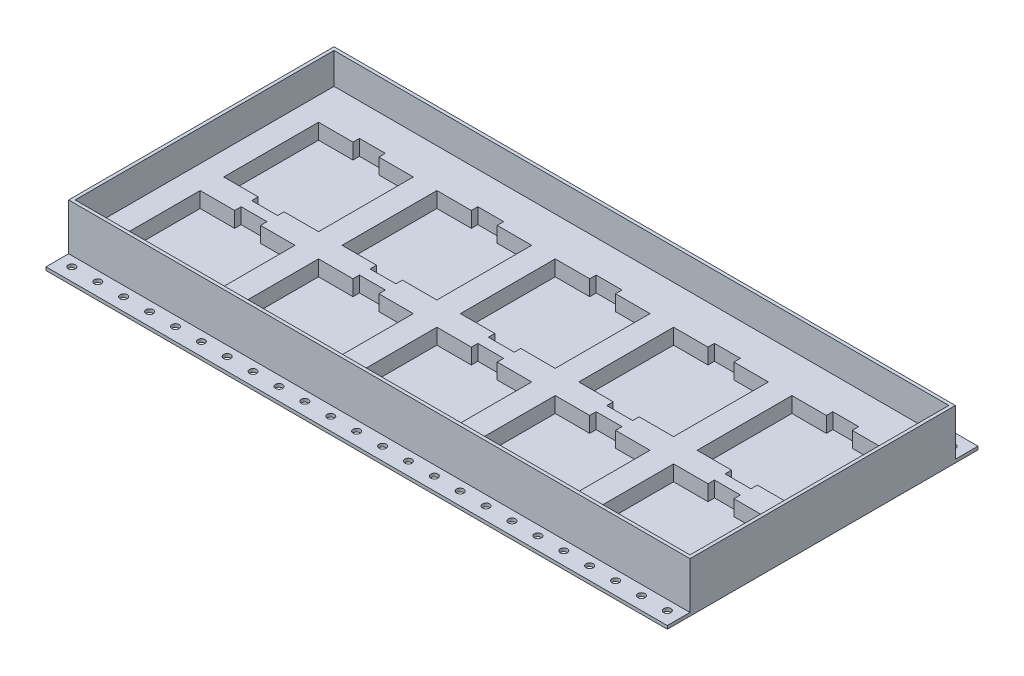
from build123d import *

# Parameters (mm, degrees)
SKETCH1_W           = 609.6
SKETCH1_H           = 304.8
SKETCH1_W_2         = 93
SKETCH1_H_2         = 93
BOSS_EXTRUDE1_DEPTH = 15.24
SKETCH2_W           = 609.6
SKETCH2_H           = 304.8
BOSS_EXTRUDE2_DEPTH = 3.175
SKETCH3_W           = 609.6
SKETCH3_H           = 304.8
SKETCH3_W_2         = 603.25
SKETCH3_H_2         = 254
BOSS_EXTRUDE3_DEPTH = 30.48
SKETCH4_OUTSIDE_W   = 748.262
SKETCH4_OUTSIDE_H   = 443.462
SKETCH4_OUTSIDE_W_2 = 609.6
SKETCH4_OUTSIDE_H_2 = 260.35
CUT_EXTRUDE1_DEPTH  = 45.72
SKETCH5_R           = 3.4925
CUT_EXTRUDE2_DEPTH  = 344.830071983
SKETCH6_W           = 25.4
SKETCH6_H           = 6.35
CUT_EXTRUDE3_DEPTH  = 15.24


with BuildPart() as part:
    # Sketch1 → Boss-Extrude1 (new body)
    with BuildSketch(Plane(origin=(0, 0, 0), x_dir=(1, 0, 0), z_dir=(0, 1, 0))):
        Rectangle(SKETCH1_W, SKETCH1_H)
        with Locations((0, 42.4)):
            Rectangle(SKETCH1_W_2, SKETCH1_H_2, mode=Mode.SUBTRACT)
        with Locations((-116.114, 42.4)):
            Rectangle(SKETCH1_W_2, SKETCH1_H_2, mode=Mode.SUBTRACT)
        with Locations((-116.114, -73.714)):
            Rectangle(SKETCH1_W_2, SKETCH1_H_2, mode=Mode.SUBTRACT)
        with Locations((0, -73.714)):
            Rectangle(SKETCH1_W_2, SKETCH1_H_2, mode=Mode.SUBTRACT)
        with Locations((-232.228, 42.4)):
            Rectangle(SKETCH1_W_2, SKETCH1_H_2, mode=Mode.SUBTRACT)
        with Locations((-232.228, -73.714)):
            Rectangle(SKETCH1_W_2, SKETCH1_H_2, mode=Mode.SUBTRACT)
        with Locations((116.114, 42.4)):
            Rectangle(SKETCH1_W_2, SKETCH1_H_2, mode=Mode.SUBTRACT)
        with Locations((116.114, -73.714)):
            Rectangle(SKETCH1_W_2, SKETCH1_H_2, mode=Mode.SUBTRACT)
        with Locations((232.228, 42.4)):
            Rectangle(SKETCH1_W_2, SKETCH1_H_2, mode=Mode.SUBTRACT)
        with Locations((232.228, -73.714)):
            Rectangle(SKETCH1_W_2, SKETCH1_H_2, mode=Mode.SUBTRACT)
    extrude(amount=BOSS_EXTRUDE1_DEPTH)

    # Sketch2 → Boss-Extrude2 (add)
    with BuildSketch(Plane(origin=(0, 0, 0), x_dir=(-1, 0, 0), z_dir=(0, -1, 0))):
        Rectangle(SKETCH2_W, SKETCH2_H)
    extrude(amount=BOSS_EXTRUDE2_DEPTH)

    # Sketch3 → Boss-Extrude3 (add)
    with BuildSketch(Plane(origin=(0, 15.24, 0), x_dir=(1, 0, 0), z_dir=(0, 1, 0))):
        Rectangle(SKETCH3_W, SKETCH3_H)
        Rectangle(SKETCH3_W_2, SKETCH3_H_2, mode=Mode.SUBTRACT)
    extrude(amount=BOSS_EXTRUDE3_DEPTH)

    # Sketch4 outside → Cut-Extrude1 (cut)
    with BuildSketch(Plane(origin=(0, 45.72, 0), x_dir=(1, 0, 0), z_dir=(0, 1, 0))):
        Rectangle(SKETCH4_OUTSIDE_W, SKETCH4_OUTSIDE_H)
        Rectangle(SKETCH4_OUTSIDE_W_2, SKETCH4_OUTSIDE_H_2, mode=Mode.SUBTRACT)
    extrude(amount=-CUT_EXTRUDE1_DEPTH, mode=Mode.SUBTRACT)

    # Sketch5 → Cut-Extrude2 (cut, through all)
    with BuildSketch(Plane(origin=(0, 0, 0), x_dir=(1, 0, 0), z_dir=(0, 1, 0))):
        with Locations(Location((-292.1, -139.7, 0), (0, 0, 270))):
            Circle(SKETCH5_R)
        with Locations(Location((-266.7, -139.7, 0), (0, 0, 270))):
            Circle(SKETCH5_R)
        with Locations(Location((-241.3, -139.7, 0), (0, 0, 270))):
            Circle(SKETCH5_R)
        with Locations(Location((-215.9, -139.7, 0), (0, 0, 270))):
            Circle(SKETCH5_R)
        with Locations(Location((-190.5, -139.7, 0), (0, 0, 270))):
            Circle(SKETCH5_R)
        with Locations(Location((-165.1, -139.7, 0), (0, 0, 270))):
            Circle(SKETCH5_R)
        with Locations(Location((-139.7, -139.7, 0), (0, 0, 270))):
            Circle(SKETCH5_R)
        with Locations(Location((-114.3, -139.7, 0), (0, 0, 270))):
            Circle(SKETCH5_R)
        with Locations(Location((-88.9, -139.7, 0), (0, 0, 270))):
            Circle(SKETCH5_R)
        with Locations(Location((-63.5, -139.7, 0), (0, 0, 270))):
            Circle(SKETCH5_R)
        with Locations(Location((-38.1, -139.7, 0), (0, 0, 270))):
            Circle(SKETCH5_R)
        with Locations(Location((-12.7, -139.7, 0), (0, 0, 270))):
            Circle(SKETCH5_R)
        with Locations(Location((12.7, 139.7, 0), (0, 0, 270))):
            Circle(SKETCH5_R)
        with Locations(Location((38.1, 139.7, 0), (0, 0, 270))):
            Circle(SKETCH5_R)
        with Locations(Location((63.5, 139.7, 0), (0, 0, 270))):
            Circle(SKETCH5_R)
        with Locations(Location((88.9, 139.7, 0), (0, 0, 270))):
            Circle(SKETCH5_R)
        with Locations(Location((114.3, 139.7, 0), (0, 0, 270))):
            Circle(SKETCH5_R)
        with Locations(Location((139.7, 139.7, 0), (0, 0, 270))):
            Circle(SKETCH5_R)
        with Locations(Location((165.1, 139.7, 0), (0, 0, 270))):
            Circle(SKETCH5_R)
        with Locations(Location((190.5, 139.7, 0), (0, 0, 270))):
            Circle(SKETCH5_R)
        with Locations(Location((215.9, 139.7, 0), (0, 0, 270))):
            Circle(SKETCH5_R)
        with Locations(Location((241.3, 139.7, 0), (0, 0, 270))):
            Circle(SKETCH5_R)
        with Locations(Location((-292.1, 139.7, 0), (0, 0, 270))):
            Circle(SKETCH5_R)
        with Locations(Location((-266.7, 139.7, 0), (0, 0, 270))):
            Circle(SKETCH5_R)
        with Locations(Location((-241.3, 139.7, 0), (0, 0, 270))):
            Circle(SKETCH5_R)
        with Locations(Location((-215.9, 139.7, 0), (0, 0, 270))):
            Circle(SKETCH5_R)
        with Locations(Location((-190.5, 139.7, 0), (0, 0, 270))):
            Circle(SKETCH5_R)
        with Locations(Location((-165.1, 139.7, 0), (0, 0, 270))):
            Circle(SKETCH5_R)
        with Locations(Location((-139.7, 139.7, 0), (0, 0, 270))):
            Circle(SKETCH5_R)
        with Locations(Location((-114.3, 139.7, 0), (0, 0, 270))):
            Circle(SKETCH5_R)
        with Locations(Location((-88.9, 139.7, 0), (0, 0, 270))):
            Circle(SKETCH5_R)
        with Locations(Location((-63.5, 139.7, 0), (0, 0, 270))):
            Circle(SKETCH5_R)
        with Locations(Location((-38.1, 139.7, 0), (0, 0, 270))):
            Circle(SKETCH5_R)
        with Locations(Location((-12.7, 139.7, 0), (0, 0, 270))):
            Circle(SKETCH5_R)
        with Locations(Location((266.7, 139.7, 0), (0, 0, 270))):
            Circle(SKETCH5_R)
        with Locations(Location((292.1, 139.7, 0), (0, 0, 270))):
            Circle(SKETCH5_R)
        with Locations(Location((12.7, -139.7, 0), (0, 0, 270))):
            Circle(SKETCH5_R)
        with Locations(Location((38.1, -139.7, 0), (0, 0, 270))):
            Circle(SKETCH5_R)
        with Locations(Location((63.5, -139.7, 0), (0, 0, 270))):
            Circle(SKETCH5_R)
        with Locations(Location((88.9, -139.7, 0), (0, 0, 270))):
            Circle(SKETCH5_R)
        with Locations(Location((114.3, -139.7, 0), (0, 0, 270))):
            Circle(SKETCH5_R)
        with Locations(Location((139.7, -139.7, 0), (0, 0, 270))):
            Circle(SKETCH5_R)
        with Locations(Location((165.1, -139.7, 0), (0, 0, 270))):
            Circle(SKETCH5_R)
        with Locations(Location((190.5, -139.7, 0), (0, 0, 270))):
            Circle(SKETCH5_R)
        with Locations(Location((215.9, -139.7, 0), (0, 0, 270))):
            Circle(SKETCH5_R)
        with Locations(Location((241.3, -139.7, 0), (0, 0, 270))):
            Circle(SKETCH5_R)
        with Locations(Location((266.7, -139.7, 0), (0, 0, 270))):
            Circle(SKETCH5_R)
        with Locations(Location((292.1, -139.7, 0), (0, 0, 270))):
            Circle(SKETCH5_R)
    extrude(amount=-CUT_EXTRUDE2_DEPTH, mode=Mode.SUBTRACT)

    # Sketch6 → Cut-Extrude3 (cut)
    with BuildSketch(Plane(origin=(0, 15.24, 0), x_dir=(1, 0, 0), z_dir=(0, 1, 0))):
        with Locations((-116.114, 92.075)):
            Rectangle(SKETCH6_W, SKETCH6_H)
        with Locations((-116.114, -24.039)):
            Rectangle(SKETCH6_W, SKETCH6_H)
        with Locations((-116.114, -7.275)):
            Rectangle(SKETCH6_W, SKETCH6_H)
        with Locations((-116.114, -123.389)):
            Rectangle(SKETCH6_W, SKETCH6_H)
        with Locations((0, -123.389)):
            Rectangle(SKETCH6_W, SKETCH6_H)
        with Locations((0, -24.039)):
            Rectangle(SKETCH6_W, SKETCH6_H)
        with Locations((0, -7.275)):
            Rectangle(SKETCH6_W, SKETCH6_H)
        with Locations((0, 92.075)):
            Rectangle(SKETCH6_W, SKETCH6_H)
        with Locations((-232.228, 92.075)):
            Rectangle(SKETCH6_W, SKETCH6_H)
        with Locations((-232.228, -7.275)):
            Rectangle(SKETCH6_W, SKETCH6_H)
        with Locations((-232.228, -24.039)):
            Rectangle(SKETCH6_W, SKETCH6_H)
        with Locations((-232.228, -123.389)):
            Rectangle(SKETCH6_W, SKETCH6_H)
        with Locations((116.114, -123.389)):
            Rectangle(SKETCH6_W, SKETCH6_H)
        with Locations((116.114, -24.039)):
            Rectangle(SKETCH6_W, SKETCH6_H)
        with Locations((116.114, -7.275)):
            Rectangle(SKETCH6_W, SKETCH6_H)
        with Locations((116.114, 92.075)):
            Rectangle(SKETCH6_W, SKETCH6_H)
        with Locations((232.228, 92.075)):
            Rectangle(SKETCH6_W, SKETCH6_H)
        with Locations((232.228, -7.275)):
            Rectangle(SKETCH6_W, SKETCH6_H)
        with Locations((232.228, -24.039)):
            Rectangle(SKETCH6_W, SKETCH6_H)
        with Locations((232.228, -123.389)):
            Rectangle(SKETCH6_W, SKETCH6_H)
    extrude(amount=-CUT_EXTRUDE3_DEPTH, mode=Mode.SUBTRACT)


solid = part.part
